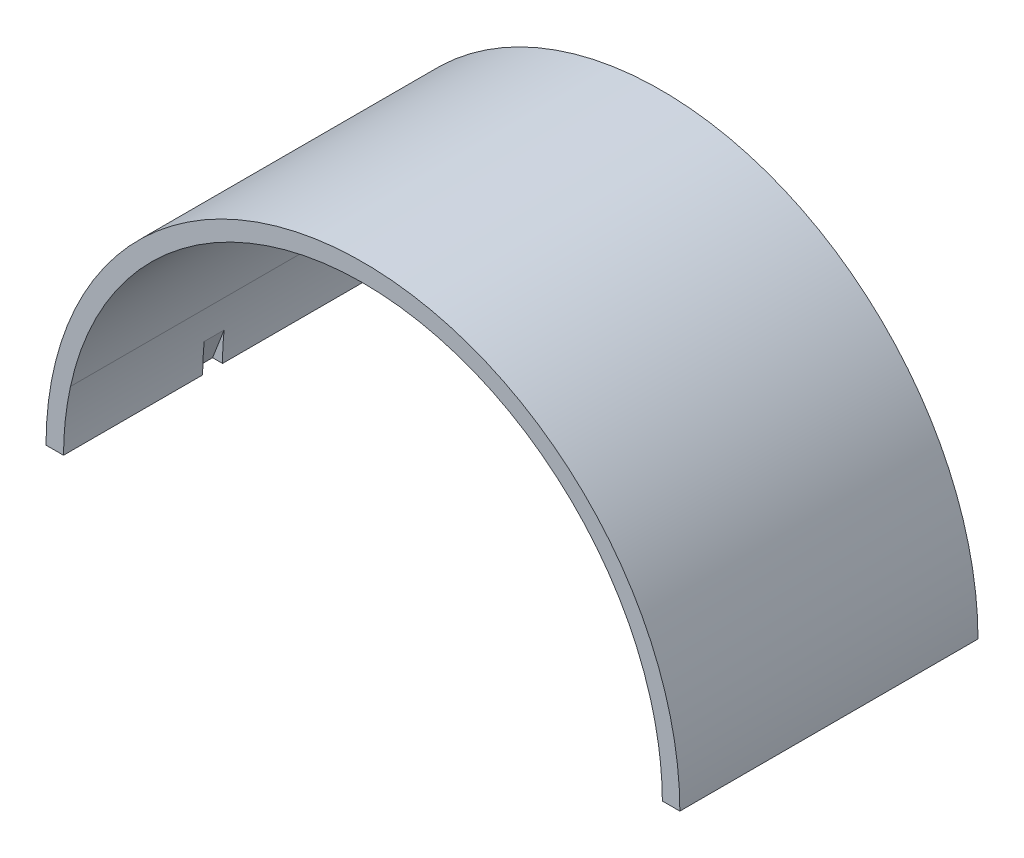
from build123d import *

# Parameters (mm, degrees)
BOSS_EXTRUDE1_DEPTH = 15
BOSS_EXTRUDE2_DEPTH = 15
SKETCH5_W           = 1
SKETCH5_H           = 2
SKETCH8_W           = 1
SKETCH8_H           = 2


with BuildPart() as part:
    # Sketch1 → Boss-Extrude1 (new, symmetric)
    with BuildSketch(Plane.XY):
        with BuildLine():
            Line((-31.891178344, 0), (-30.472178344, 0))
            ThreePointArc((-30.472178344, 0), (0, 30.472178344), (30.472178344, 0))
            Line((30.472178344, 0), (31.891178344, 0))
            ThreePointArc((31.891178344, 0), (0, 31.891178344), (-31.891178344, 0))
        make_face()
    extrude(amount=BOSS_EXTRUDE1_DEPTH, both=True)

    # Sketch2 → Boss-Extrude2 (add, symmetric)
    with BuildSketch(Plane.XY):
        with BuildLine():
            Line((-30.129278344, 0), (-30.472178344, 0))
            ThreePointArc((-30.472178344, 0), (0, 30.472178344), (30.472178344, 0))
            Line((30.472178344, 0), (30.129278344, 0))
            ThreePointArc((30.129278344, 0), (29.947091618, 3.193657531), (29.427339134, 6.35))
            add(Edge.make_bspline(
                [(29.427339134, 6.35), (24.299524612, 30.091178344), (0, 30.091178344), (-24.299524612, 30.091178344), (-29.427339134, 6.35)],
                knots=[0.212623764, 0.212623764, 0.212623764, 1.570796327, 1.570796327, 2.928968889, 2.928968889, 2.928968889], degree=2, weights=[1, 0.778146934, 1, 0.778146934, 1]))
            ThreePointArc((-29.427339134, 6.35), (-29.947091618, 3.193657531), (-30.129278344, 0))
        make_face()
    extrude(amount=BOSS_EXTRUDE2_DEPTH, both=True)

    # Sweep1: sweep along a path in Sketch6
    with BuildLine(Plane.XY) as sweep1_path:
        Line((-32.891178344, 0), (-31.749759939, 3))
    # Sketch5 → Sweep1 (sweep)
    with BuildSketch(Plane(origin=(0, 0, 0), x_dir=(1, 0, 0), z_dir=(0, 1, 0))):
        with Locations((-32.391178344, 0)):
            Rectangle(SKETCH5_W, SKETCH5_H)
    sweep(path=sweep1_path.line)

    # Cut-Sweep1: sweep along a path in Sketch9
    with BuildLine(Plane.XY) as cut_sweep1_path:
        Line((-31.129278344, 0), (-29.967865469, 3))
    # Sketch8 → Cut-Sweep1 (sweep, cut)
    with BuildSketch(Plane(origin=(0, 0, 0), x_dir=(1, 0, 0), z_dir=(0, 1, 0))):
        with Locations((-30.629278344, 0)):
            Rectangle(SKETCH8_W, SKETCH8_H)
    sweep(path=cut_sweep1_path.line, mode=Mode.SUBTRACT)


solid = part.part
